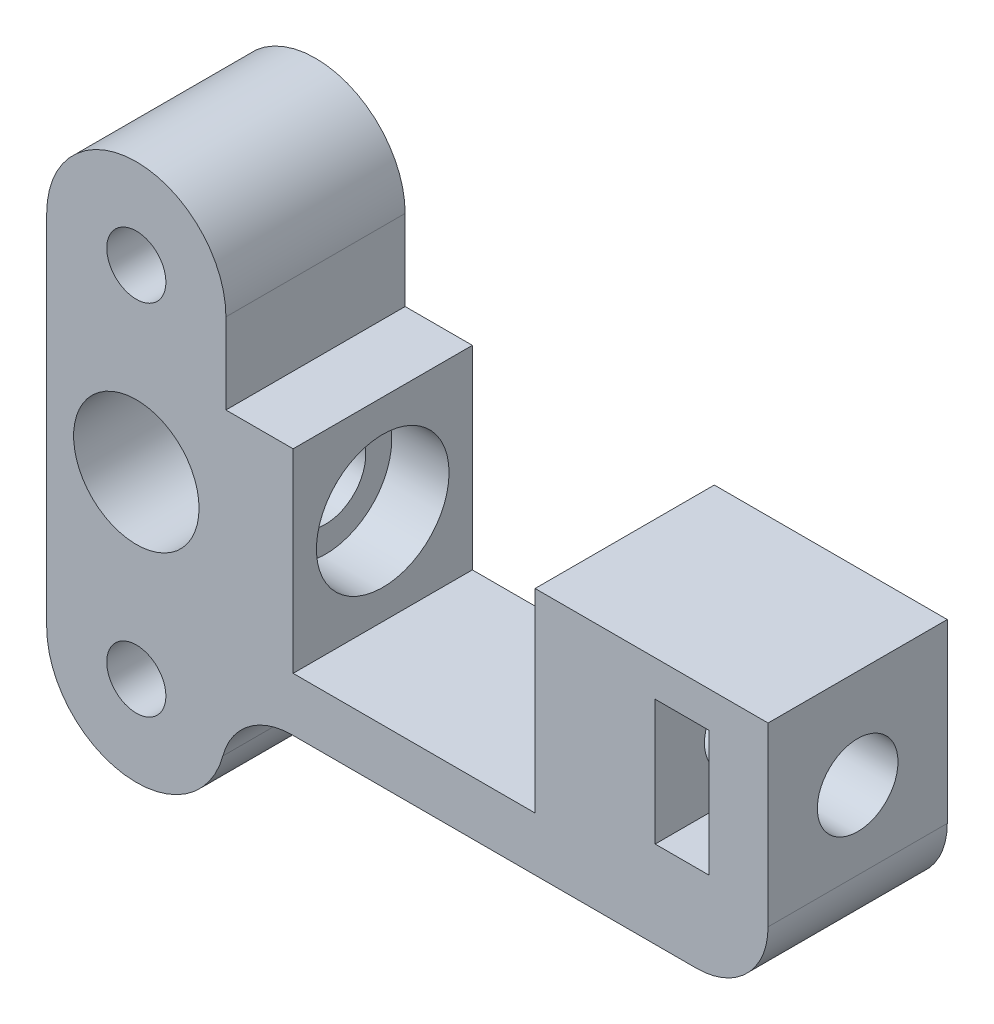
from build123d import *

# Parameters (mm, degrees)
ESQUISSE1_R          = 1.65
ESQUISSE1_R_2        = 3.5
SHAPE_DEPTH          = 10
ESQUISSE6_W          = 10
ESQUISSE6_H          = 15
MAINSHAPE_DEPTH      = 30.25
ESQUISSE10_W         = 13.5
ESQUISSE10_H         = 12.85118471
SPACEREMOVER_DEPTH   = 13
ESQUISSE11_R         = 2.25
AXE_DEPTH            = 16
ESQUISSE12_R         = 3.7
BEARINGBOTTOM_DEPTH  = 3.2
BEARINGTOP_START     = -3.4
ESQUISSE14_R         = 3.7
BEARINGTOP_DEPTH     = 3.4
ESQUISSE15_R         = 2.25
AXEEND_DEPTH         = 1
ESQUISSE16_W         = 3
ESQUISSE16_H         = 7
AXELOCKER_DEPTH      = 10
ESQUISSE17_W         = 30.25
ESQUISSE17_H         = 0.85118471
RENFORCMENT_DEPTH    = 10
ESQUISSE18_W         = 30.25
ESQUISSE18_H         = 2
MASSREMOVER_DEPTH    = 10
CONG_1_R             = 4
ESQUISSE19_R         = 1
REMOVER_HELPER_DEPTH = 10


with BuildPart() as part:
    # Esquisse1 → Shape (new body)
    with BuildSketch(Plane.XY):
        with BuildLine():
            ThreePointArc((5, 10), (0, 15), (-5, 10))
            Line((-5, 10), (-5, -10))
            ThreePointArc((-5, -10), (0, -15), (5, -10))
            Line((5, -10), (5, 10))
        make_face()
        with Locations((0, 10)):
            Circle(ESQUISSE1_R, mode=Mode.SUBTRACT)
        Circle(ESQUISSE1_R_2, mode=Mode.SUBTRACT)
        with Locations((0, -10)):
            Circle(ESQUISSE1_R, mode=Mode.SUBTRACT)
    extrude(amount=SHAPE_DEPTH)

    # Esquisse6 → MainShape (add)
    with BuildSketch(Plane(origin=(5, 0, 0), x_dir=(0, 0, -1), z_dir=(1, 0, 0))):
        with Locations((-5, 0)):
            Rectangle(ESQUISSE6_W, ESQUISSE6_H)
    extrude(amount=MAINSHAPE_DEPTH)

    # Esquisse10 → SpaceRemover (cut)
    with BuildSketch(Plane(origin=(0, 0, 0), x_dir=(-1, 0, 0), z_dir=(0, 0, -1))):
        with Locations((-15.5, 1.074407645)):
            Rectangle(ESQUISSE10_W, ESQUISSE10_H)
    extrude(amount=-SPACEREMOVER_DEPTH, mode=Mode.SUBTRACT)

    # Esquisse11 → Axe (cut)
    with BuildSketch(Plane(origin=(35.25, 0, 0), x_dir=(0, 0, -1), z_dir=(1, 0, 0))):
        with Locations((-5, 0)):
            Circle(ESQUISSE11_R)
    extrude(amount=-AXE_DEPTH, mode=Mode.SUBTRACT)

    # Esquisse12 → BearingBottom (cut)
    with BuildSketch(Plane(origin=(8.75, 0, 0), x_dir=(0, 0, -1), z_dir=(1, 0, 0))):
        with Locations((-5, 0)):
            Circle(ESQUISSE12_R)
    extrude(amount=-BEARINGBOTTOM_DEPTH, mode=Mode.SUBTRACT)

    # Esquisse14 → BearingTop (cut)
    with BuildSketch(Plane.ZY.offset(-22.25).offset(BEARINGTOP_START)):
        with Locations(Location((5, 0, 0), (0, 0, 180))):
            Circle(ESQUISSE14_R)
    extrude(amount=BEARINGTOP_DEPTH, mode=Mode.SUBTRACT)

    # Esquisse15 → AxeEnd (cut)
    with BuildSketch(Plane(origin=(5.55, 0, 0), x_dir=(0, 0, -1), z_dir=(1, 0, 0))):
        with Locations((-5, 0)):
            Circle(ESQUISSE15_R)
    extrude(amount=-AXEEND_DEPTH, mode=Mode.SUBTRACT)

    # Esquisse16 → AxeLocker (cut)
    with BuildSketch(Plane(origin=(0, 0, 0), x_dir=(-1, 0, 0), z_dir=(0, 0, -1))):
        with Locations((-30.45, 0)):
            Rectangle(ESQUISSE16_W, ESQUISSE16_H)
    extrude(amount=-AXELOCKER_DEPTH, mode=Mode.SUBTRACT)

    # Esquisse17 → Renforcment (add)
    with BuildSketch(Plane(origin=(0, 0, 0), x_dir=(-1, 0, 0), z_dir=(0, 0, -1))):
        with Locations((-20.125, -7.925592355)):
            Rectangle(ESQUISSE17_W, ESQUISSE17_H)
    extrude(amount=-RENFORCMENT_DEPTH)

    # Esquisse18 → MassRemover (cut)
    with BuildSketch(Plane(origin=(0, 0, 0), x_dir=(-1, 0, 0), z_dir=(0, 0, -1))):
        with Locations((-20.125, 6.5)):
            Rectangle(ESQUISSE18_W, ESQUISSE18_H)
    extrude(amount=-MASSREMOVER_DEPTH, mode=Mode.SUBTRACT)

    # Congé1
    cong_1_edges = [part.edges().sort_by_distance(p)[0] for p in [
        (35.25, -8.35118471, 5),
        (5, -8.35118471, 5),
    ]]
    fillet(cong_1_edges, radius=CONG_1_R)

    # Esquisse19 → Remover helper (cut)
    with BuildSketch(Plane(origin=(4.55, 0, 0), x_dir=(0, 0, -1), z_dir=(1, 0, 0))):
        with Locations((-5, 0)):
            Circle(ESQUISSE19_R)
    extrude(amount=-REMOVER_HELPER_DEPTH, mode=Mode.SUBTRACT)


solid = part.part
